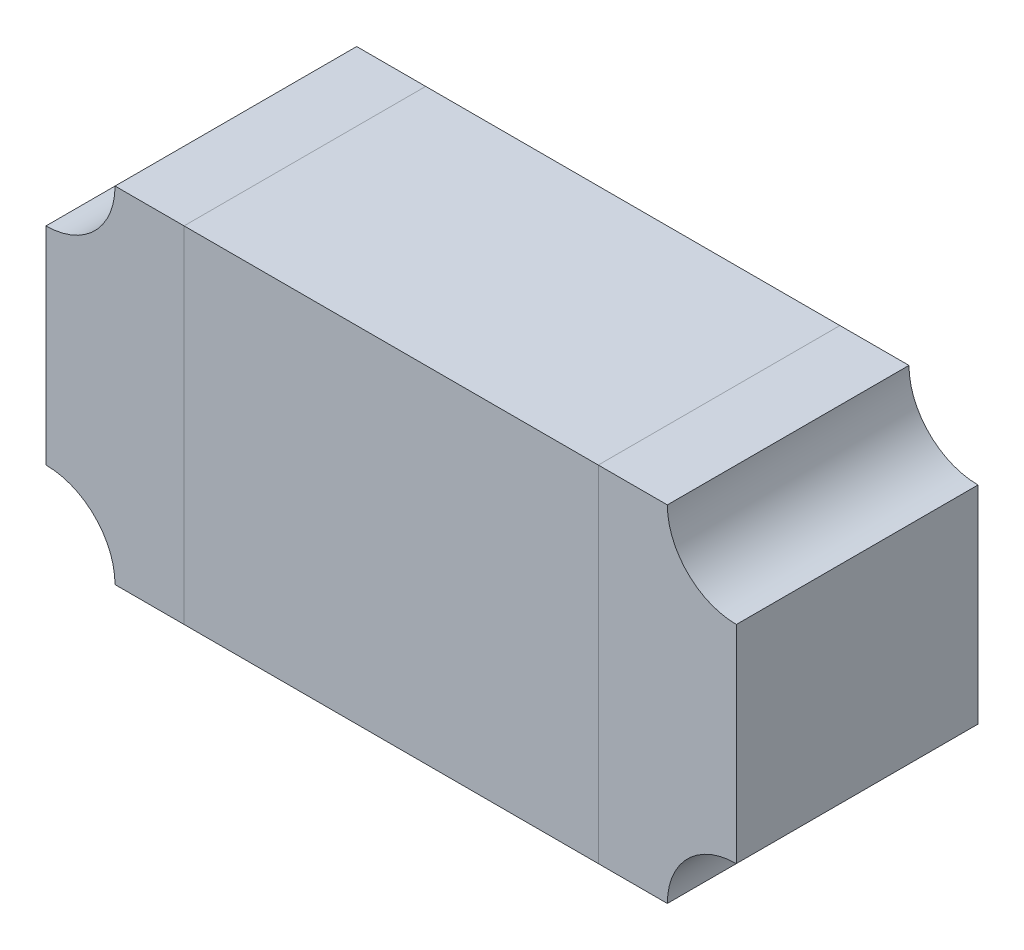
from build123d import *

# Parameters (mm, degrees)
SKETCH1_W             = 0.6
SKETCH1_H             = 0.5
BOSS_EXTRUDE1_DEPTH   = 0.35
BOSS_EXTRUDE2_DEPTH   = 0.35
BOSS_EXTRUDE2_2_DEPTH = 0.35


with BuildPart() as part:
    # Sketch1 → Boss-Extrude1 (new body)
    with BuildSketch(Plane.XY):
        Rectangle(SKETCH1_W, SKETCH1_H)
    extrude(amount=BOSS_EXTRUDE1_DEPTH)


with BuildPart() as body_2:
    # Sketch2 → Boss-Extrude2 (new body)
    with BuildSketch(Plane.XY):
        with BuildLine():
            Line((-0.3, -0.25), (-0.4, -0.25))
            ThreePointArc((-0.4, -0.25), (-0.429289322, -0.179289322), (-0.5, -0.15))
            Line((-0.5, -0.15), (-0.5, 0.15))
            ThreePointArc((-0.5, 0.15), (-0.429289322, 0.179289322), (-0.4, 0.25))
            Line((-0.4, 0.25), (-0.3, 0.25))
            Line((-0.3, 0.25), (-0.3, -0.25))
        make_face()
    extrude(amount=BOSS_EXTRUDE2_DEPTH)


with BuildPart() as body_3:
    # Sketch2 → Boss-Extrude2 2 (new body)
    with BuildSketch(Plane.XY):
        with BuildLine():
            Line((0.3, 0.25), (0.3, -0.25))
            Line((0.3, -0.25), (0.4, -0.25))
            ThreePointArc((0.4, -0.25), (0.429289322, -0.179289322), (0.5, -0.15))
            Line((0.5, -0.15), (0.5, 0.15))
            ThreePointArc((0.5, 0.15), (0.429289322, 0.179289322), (0.4, 0.25))
            Line((0.4, 0.25), (0.3, 0.25))
        make_face()
    extrude(amount=BOSS_EXTRUDE2_2_DEPTH)


solid = Compound([part.part, body_2.part, body_3.part])
